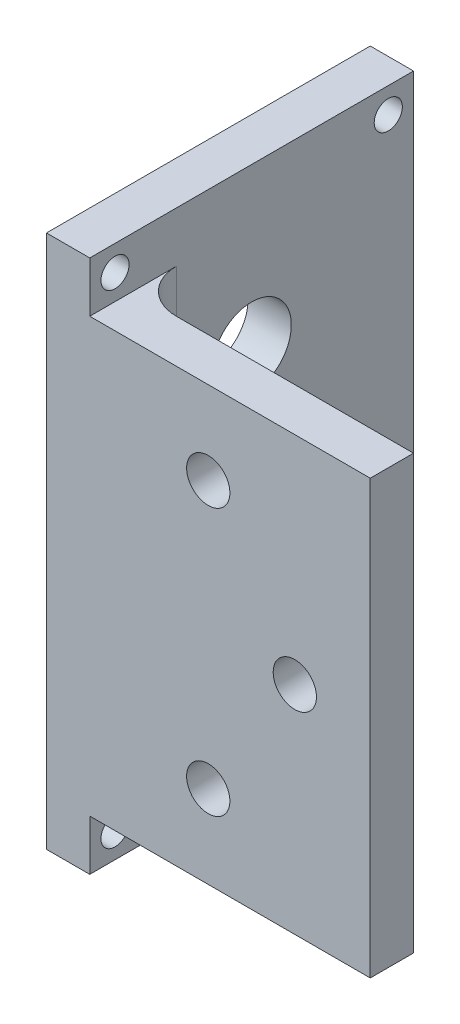
from build123d import *

# Parameters (mm, degrees)
BOSS_EXTRUDE1_DEPTH = 37
FILLET1_R           = 3
SKETCH2_R           = 1.5
SKETCH2_W           = 19.44
SKETCH2_H           = 3.5
CUT_EXTRUDE1_DEPTH  = 49.745330033
SKETCH3_R           = 0.975
SKETCH3_R_2         = 2.75
CUT_EXTRUDE2_DEPTH  = 49.745330033


with BuildPart() as part:
    # Sketch1 → Boss-Extrude1 (new body)
    with BuildSketch(Plane(origin=(0, 0, 0), x_dir=(1, 0, 0), z_dir=(0, 1, 0))):
        Polygon((0, 0), (22.44, 0), (22.44, 3), (3, 3), (3, 22.44), (0, 22.44), align=None)
    extrude(amount=BOSS_EXTRUDE1_DEPTH)

    # Fillet1
    fillet1_edges = [part.edges().sort_by_distance(p)[0] for p in [
        (3, 18.5, -3),
    ]]
    fillet(fillet1_edges, radius=FILLET1_R)

    # Sketch2 → Cut-Extrude1 (cut, through all)
    with BuildSketch(Plane(origin=(0, 0, -22.44), x_dir=(-1, 0, 0), z_dir=(0, 0, -1))):
        with Locations((-11.212785563, 27.75)):
            Circle(SKETCH2_R)
        with Locations((-17.212785563, 18.5)):
            Circle(SKETCH2_R)
        with Locations((-11.212785563, 9.25)):
            Circle(SKETCH2_R)
        with Locations((-12.72, 1.75)):
            Rectangle(SKETCH2_W, SKETCH2_H)
        with Locations((-12.72, 35.25)):
            Rectangle(SKETCH2_W, SKETCH2_H)
    extrude(amount=-CUT_EXTRUDE1_DEPTH, mode=Mode.SUBTRACT)

    # Sketch3 → Cut-Extrude2 (cut, through all)
    with BuildSketch(Plane.ZY):
        with Locations((-1.75, 35.25)):
            Circle(SKETCH3_R)
        with Locations((-1.75, 1.75)):
            Circle(SKETCH3_R)
        with Locations((-20.69, 1.75)):
            Circle(SKETCH3_R)
        with Locations((-20.69, 35.25)):
            Circle(SKETCH3_R)
        with Locations((-11.22, 26)):
            Circle(SKETCH3_R_2)
    extrude(amount=-CUT_EXTRUDE2_DEPTH, mode=Mode.SUBTRACT)


solid = part.part
